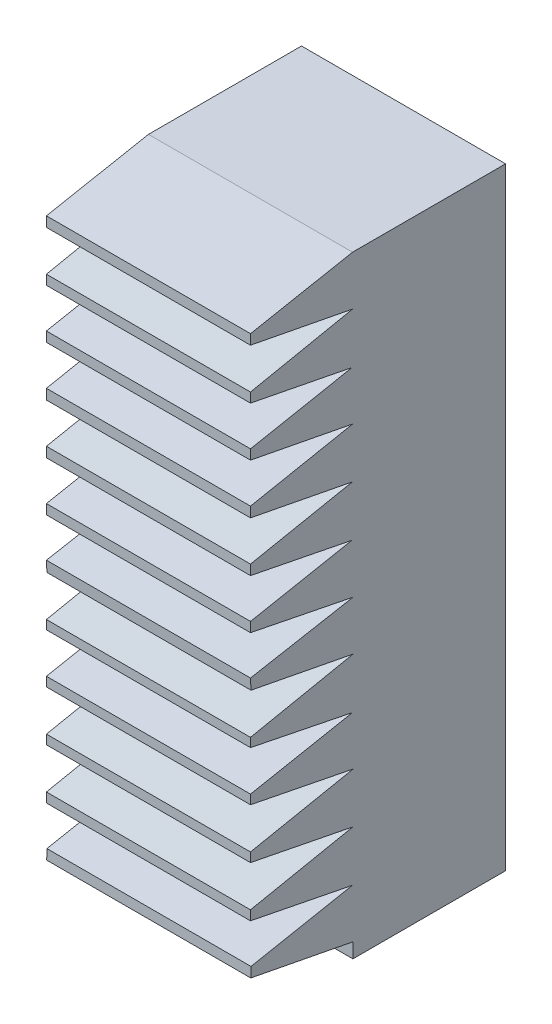
from build123d import *

# Parameters (mm, degrees)
CROQUIS1_W              = 2
CROQUIS1_H              = 6
SALIENTE_EXTRUIR1_DEPTH = 2.5
CORTAR_EXTRUIR1_DEPTH   = 7.800735254


with BuildPart() as part:
    # Croquis1 → Saliente-Extruir1 (new body)
    with BuildSketch(Plane.XY):
        with Locations((1, 3)):
            Rectangle(CROQUIS1_W, CROQUIS1_H)
    extrude(amount=SALIENTE_EXTRUIR1_DEPTH)

    # Croquis2 → Cortar-Extruir1 (cut, through all)
    with BuildSketch(Plane(origin=(0, 0, 0), x_dir=(0, 0, -1), z_dir=(1, 0, 0))):
        Polygon((-1.5, 6), (-2.5, 5.80854163), (-2.5, 5.710449631), (-1.5, 5.517083259), (-2.5, 5.313214879), (-2.5, 5.218807214), (-1.505093933, 5.023577449), (-2.5, 4.831133188), (-2.5, 4.734716849), (-1.499108678, 4.541270078), (-2.5, 4.344872298), (-2.5, 4.244926288), (-1.501926313, 4.051435435), (-2.5, 3.852830402), (-2.5, 3.75480643), (-1.507020246, 3.557929626), (-2.5, 3.366554621), (-2.5, 3.270551035), (-1.495260568, 3.069261664), (-2.5, 2.885869762), (-2.495260568, 2.779711295), (-1.495260568, 2.586344923), (-2.5, 2.382343868), (-2.5, 2.294774147), (-1.500354501, 2.092839113), (-2.5, 1.900710404), (-2.5, 1.810013194), (-1.494369246, 1.610531741), (-2.5, 1.40969447), (-2.5, 1.31899726), (-1.497186881, 1.120697099), (-2.5, 0.918678537), (-2.5, 0.824853836), (-1.502280814, 0.627191289), (-2.495260568, 0.435816284), (-2.497186881, 0.338330689), (-1.496295559, 0.144883917), (-1.496295559, 0), (-2.562577576, 0), (-2.562577576, 6), align=None)
    extrude(amount=CORTAR_EXTRUIR1_DEPTH, mode=Mode.SUBTRACT)


solid = part.part
